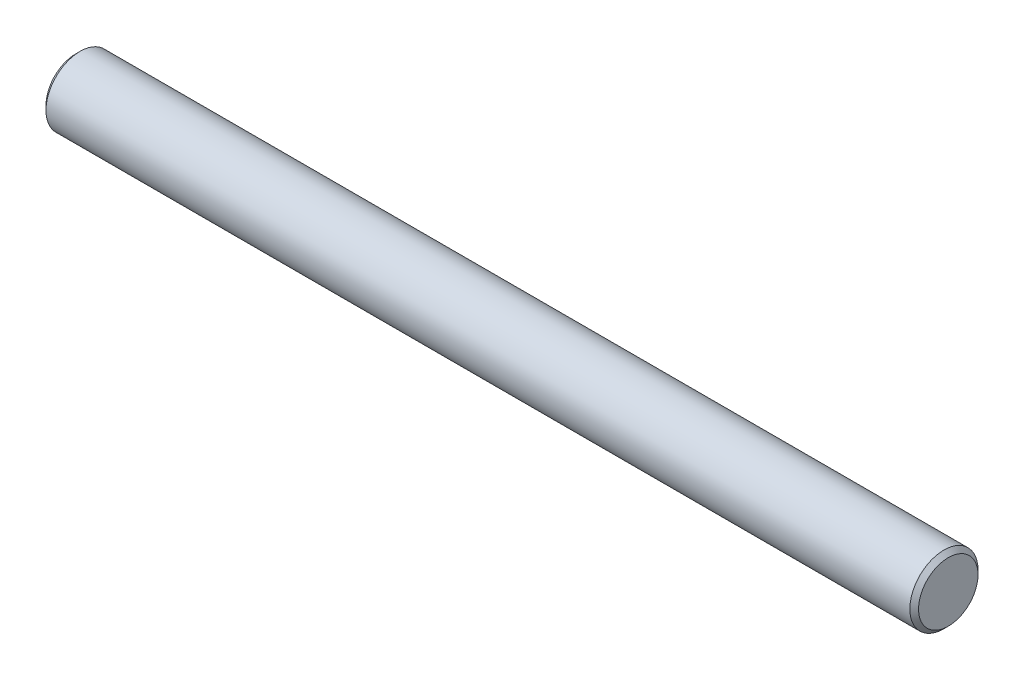
from build123d import *

# Parameters (mm, degrees)
SKETCH1_W                    = 320
SKETCH1_H                    = 12.5
CHAMFER1_SIZE                = 1.6
M10_TAPPED_HOLE1_D           = 8.5
M10_TAPPED_HOLE1_DEPTH       = 24.5
M10_TAPPED_HOLE1_CBORE_D     = 10
M10_TAPPED_HOLE1_CBORE_DEPTH = 20
M10_TAPPED_HOLE1_TIP         = 2.553657631


with BuildPart() as part:
    # Sketch1 → Revolve1 (revolve)
    with BuildSketch(Plane.XY, mode=Mode.PRIVATE) as revolve1_sk:
        with Locations((-160, 6.25)):
            Rectangle(SKETCH1_W, SKETCH1_H)
    revolve(revolve1_sk.sketch.rotate(Axis((0, 0, 0), (-1, 0, 0)), 90), axis=Axis((0, 0, 0), (-1, 0, 0)))

    # Chamfer1
    chamfer1_edges = [part.edges().sort_by_distance(p)[0] for p in [
        (-320, 0, 12.5),
        (0, 0, 12.5),
    ]]
    chamfer(chamfer1_edges, length=CHAMFER1_SIZE)

    # M10 Tapped Hole1
    with Locations(Plane.ZY.offset(320)):
        with Locations((0, 0)):
            CounterBoreHole(M10_TAPPED_HOLE1_D / 2, M10_TAPPED_HOLE1_CBORE_D / 2, M10_TAPPED_HOLE1_CBORE_DEPTH, depth=M10_TAPPED_HOLE1_DEPTH)
            with Locations((0, 0, -(M10_TAPPED_HOLE1_DEPTH + M10_TAPPED_HOLE1_TIP / 2))):  # 118° drill point
                Cone(0, M10_TAPPED_HOLE1_D / 2, M10_TAPPED_HOLE1_TIP, mode=Mode.SUBTRACT)


solid = part.part
